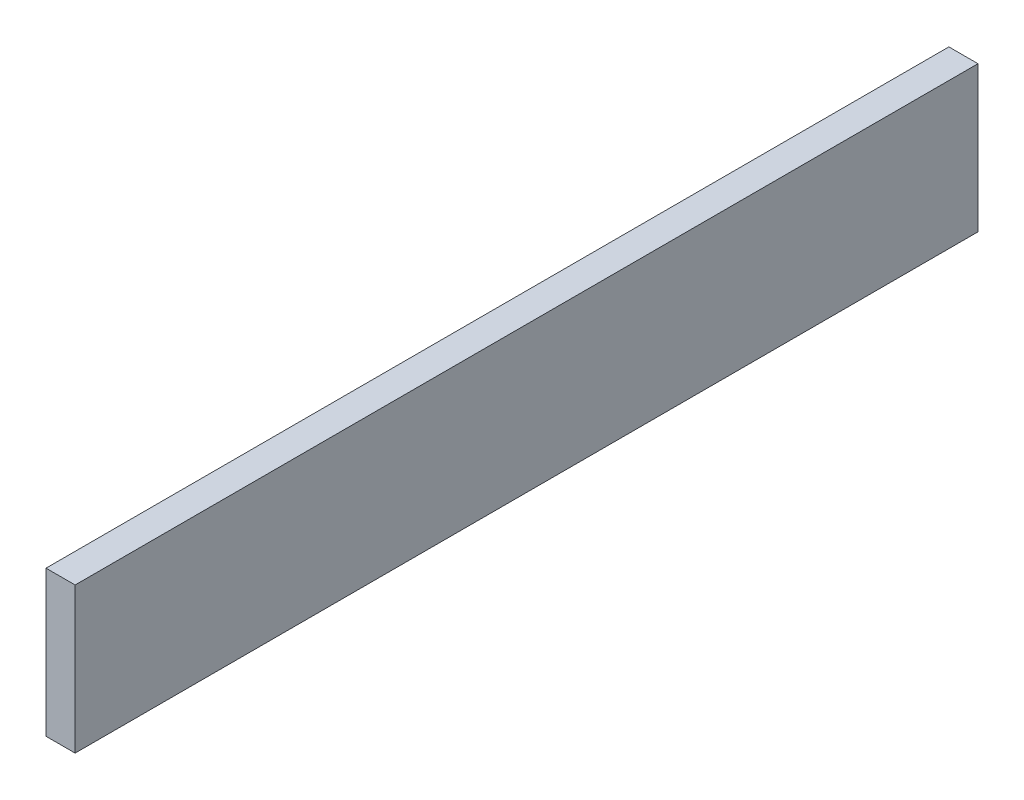
from build123d import *

# Parameters (mm, degrees)
SKETCH1_W           = 393.7
SKETCH1_H           = 63.5
BOSS_EXTRUDE1_DEPTH = 12.7


with BuildPart() as part:
    # Sketch1 → Boss-Extrude1 (new body)
    with BuildSketch(Plane(origin=(0, 0, 0), x_dir=(0, 0, -1), z_dir=(1, 0, 0))):
        with Locations((196.85, 31.75)):
            Rectangle(SKETCH1_W, SKETCH1_H)
    extrude(amount=BOSS_EXTRUDE1_DEPTH)


solid = part.part
